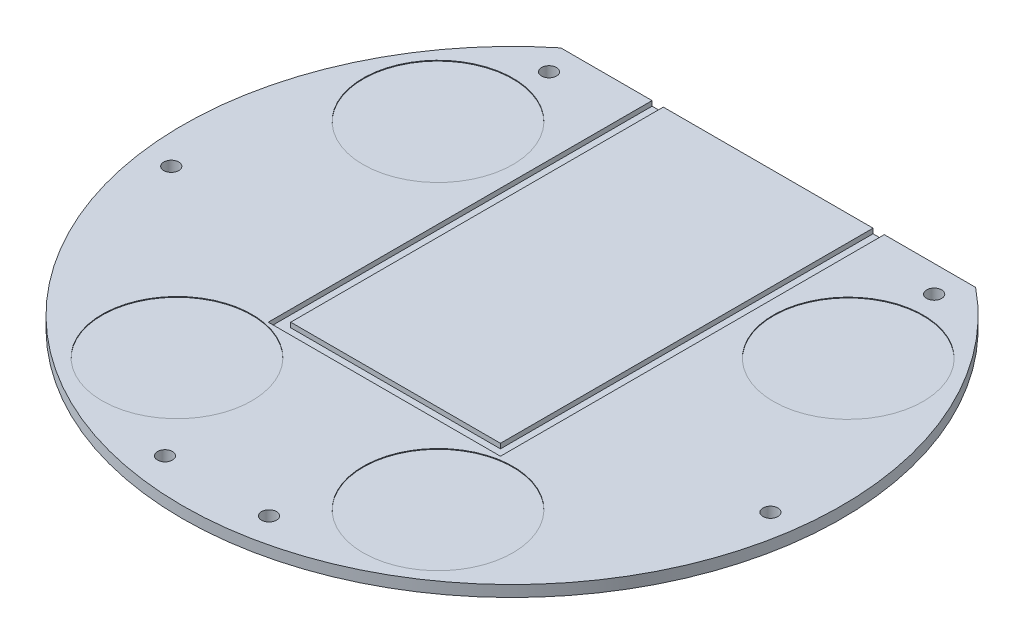
from build123d import *

# Parameters (mm, degrees)
BOSS_EXTRUDE1_DEPTH   = 3
CUT_EXTRUDE2_DEPTH    = 1.3
SKETCH4_R             = 20
CUT_EXTRUDE3_DEPTH    = 0.2
F_4_0MM_DOWEL_HOLE1_D = 4
SKETCH8_R             = 2
CUT_EXTRUDE4_DEPTH    = 19


with BuildPart() as part:
    # Sketch1 → Boss-Extrude1 (new body)
    with BuildSketch(Plane(origin=(0, 0, 0), x_dir=(1, 0, 0), z_dir=(0, 1, 0))):
        with BuildLine():
            Line((55.380194412, 68.388844608), (0, 68.388844608))
            Line((0, 68.388844608), (-55.380194412, 68.388844608))
            ThreePointArc((-55.380194412, 68.388844608), (-37.884976519, -79.427505023), (88, 0))
            ThreePointArc((88, 0), (79.427505023, 37.884976519), (55.380194412, 68.388844608))
        make_face()
    extrude(amount=BOSS_EXTRUDE1_DEPTH)

    # Sketch3 → Cut-Extrude2 (cut)
    with BuildSketch(Plane(origin=(0, 3, 0), x_dir=(1, 0, 0), z_dir=(0, 1, 0))):
        Polygon((28, -31.1), (0, -31.1), (-28, -31.1), (-28, 68.388844608), (-31, 68.388844608), (-31, -34.1), (31, -34.1), (31, 68.388844608), (28, 68.388844608), align=None)
    extrude(amount=-CUT_EXTRUDE2_DEPTH, mode=Mode.SUBTRACT)

    # Sketch4 → Cut-Extrude3 (cut)
    with BuildSketch(Plane(origin=(0, 3, 0), x_dir=(1, 0, 0), z_dir=(0, 1, 0))):
        with Locations(Location((35, -54.772, 0), (0, 0, 270))):
            Circle(SKETCH4_R)
        with Locations(Location((-35, -54.472, 0), (0, 0, 270))):
            Circle(SKETCH4_R)
        with Locations(Location((54.772, 35, 0), (0, 0, 270))):
            Circle(SKETCH4_R)
        with Locations(Location((-54.772, 35, 0), (0, 0, 270))):
            Circle(SKETCH4_R)
    extrude(amount=-CUT_EXTRUDE3_DEPTH, mode=Mode.SUBTRACT)

    # Ø4.0mm Dowel Hole1 (through all)
    with Locations(Plane(origin=(-51.423008775, 3, -61.28355545), x_dir=(0, 0, 1), z_dir=(0, 1, 0))):
        with Locations((0, 0), (0, 102.84601755), (140.068175691, 65.314862988), (140.068175691, 37.531154562)):
            Hole(F_4_0MM_DOWEL_HOLE1_D / 2)

    # Sketch8 → Cut-Extrude4 (cut)
    with BuildSketch(Plane(origin=(0, 3, 0), x_dir=(1, 0, 0), z_dir=(0, 1, 0))):
        with Locations(Location((-80, -11, 0), (0, 0, 270))):
            Circle(SKETCH8_R)
        with Locations(Location((80, -11, 0), (0, 0, 270))):
            Circle(SKETCH8_R)
    extrude(amount=-CUT_EXTRUDE4_DEPTH, mode=Mode.SUBTRACT)


solid = part.part
